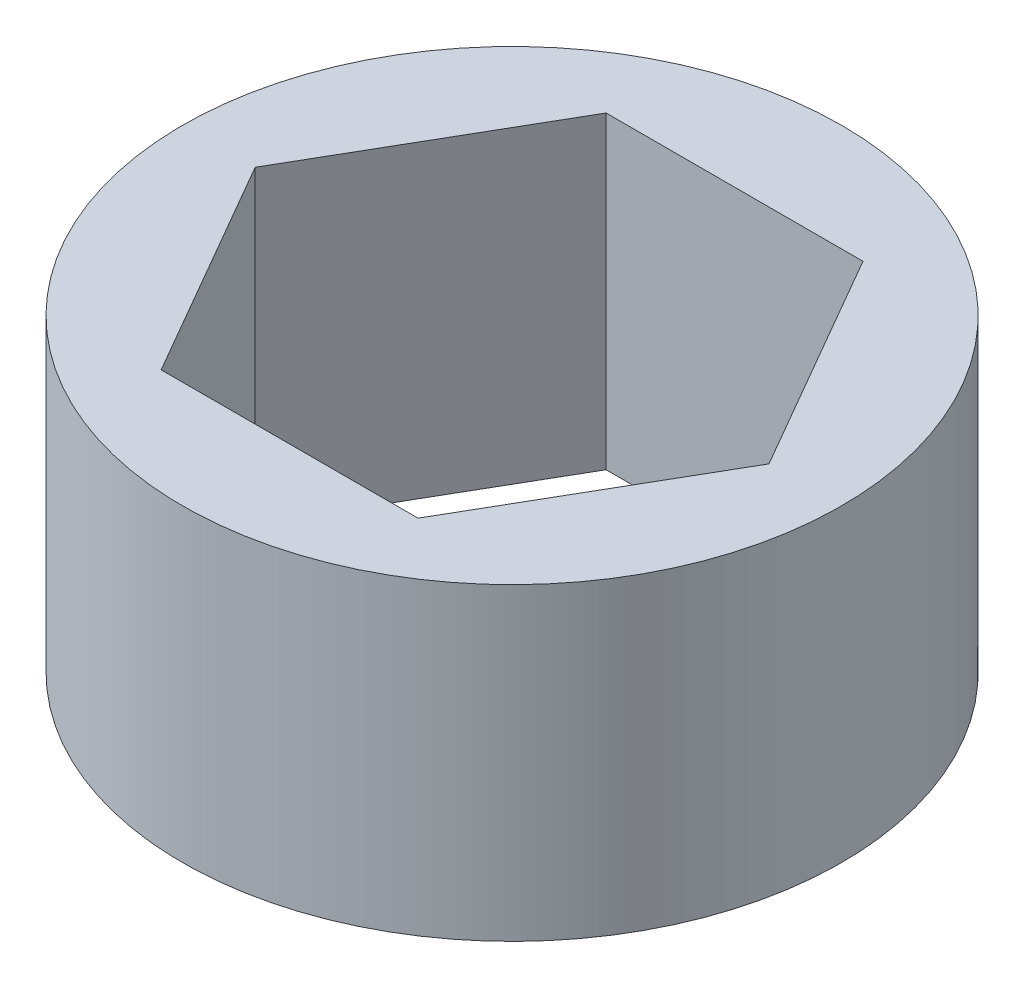
from build123d import *

# Parameters (mm, degrees)
SKETCH1_R           = 10.16
BOSS_EXTRUDE1_DEPTH = 9.525


with BuildPart() as part:
    # Sketch1 → Boss-Extrude1 (new body)
    with BuildSketch(Plane(origin=(0, 0, 0), x_dir=(1, 0, 0), z_dir=(0, 1, 0))):
        with Locations(Location((0, 0, 0), (0, 0, 90))):
            Circle(SKETCH1_R)
        Polygon((7.918936292, 0), (3.959468146, 6.858), (-3.959468146, 6.858), (-7.918936292, 0), (-3.959468146, -6.858), (3.959468146, -6.858), align=None, mode=Mode.SUBTRACT)
    extrude(amount=BOSS_EXTRUDE1_DEPTH)


solid = part.part
